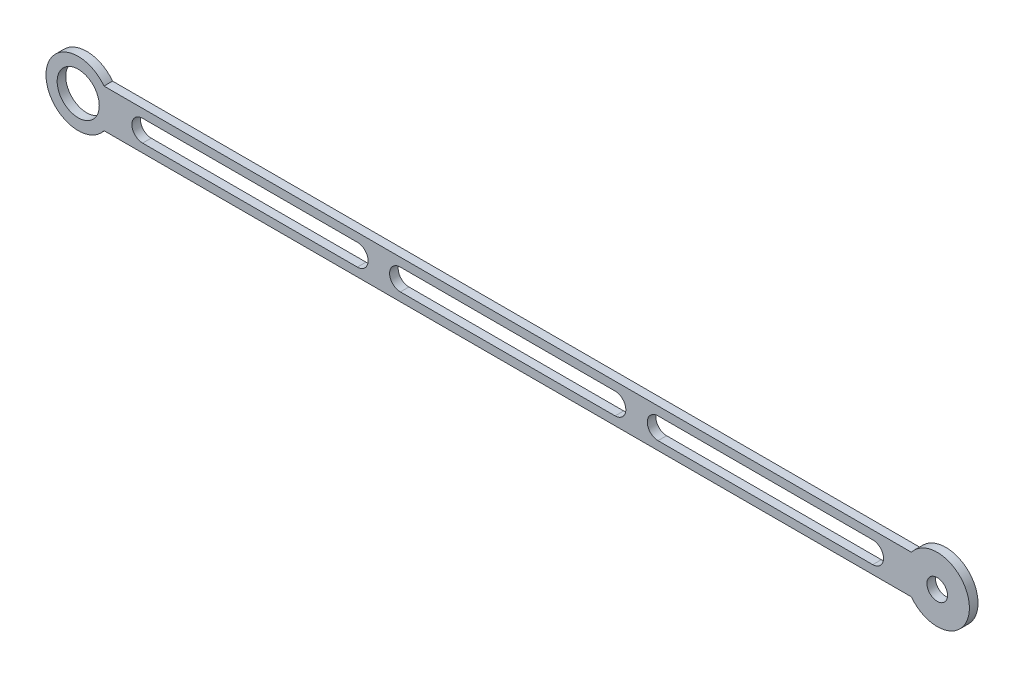
from build123d import *

# Parameters (mm, degrees)
SKETCH1_R           = 7.5
SKETCH1_R_2         = 4.9
SKETCH1_R_3         = 2.4
SKETCH1_W           = 188
SKETCH1_H           = 9
BOSS_EXTRUDE1_DEPTH = 2
CUT_EXTRUDE1_DEPTH  = 208.645129969


with BuildPart() as part:
    # Sketch1 → Boss-Extrude1 (new body)
    # profile 1 of 3: a face of its own
    with BuildSketch(Plane.XY):
        Circle(SKETCH1_R)
        Circle(SKETCH1_R_2, mode=Mode.SUBTRACT)
    # profile 2 of 3: a face of its own
    with BuildSketch(Plane.XY):
        with Locations((200, 0)):
            Circle(SKETCH1_R)
        with Locations((200, 0)):
            Circle(SKETCH1_R_3, mode=Mode.SUBTRACT)
    # profile 3 of 3: a face of its own
    with BuildSketch(Plane.XY):
        with Locations((100, 0)):
            Rectangle(SKETCH1_W, SKETCH1_H)
    extrude(amount=BOSS_EXTRUDE1_DEPTH)

    # Sketch2 → Cut-Extrude1 (cut, through all)
    with BuildSketch(Plane.XY.offset(2)):
        with BuildLine():
            Line((75, 2.5), (125, 2.5))
            ThreePointArc((125, 2.5), (127.5, 0), (125, -2.5))
            Line((125, -2.5), (75, -2.5))
            ThreePointArc((75, -2.5), (72.5, 0), (75, 2.5))
        make_face()
        with BuildLine():
            Line((135, 2.5), (185, 2.5))
            ThreePointArc((185, 2.5), (187.5, 0), (185, -2.5))
            Line((185, -2.5), (135, -2.5))
            ThreePointArc((135, -2.5), (132.5, 0), (135, 2.5))
        make_face()
        with BuildLine():
            Line((15, 2.5), (65, 2.5))
            ThreePointArc((65, 2.5), (67.5, 0), (65, -2.5))
            Line((65, -2.5), (15, -2.5))
            ThreePointArc((15, -2.5), (12.5, 0), (15, 2.5))
        make_face()
    extrude(amount=-CUT_EXTRUDE1_DEPTH, mode=Mode.SUBTRACT)


solid = part.part
